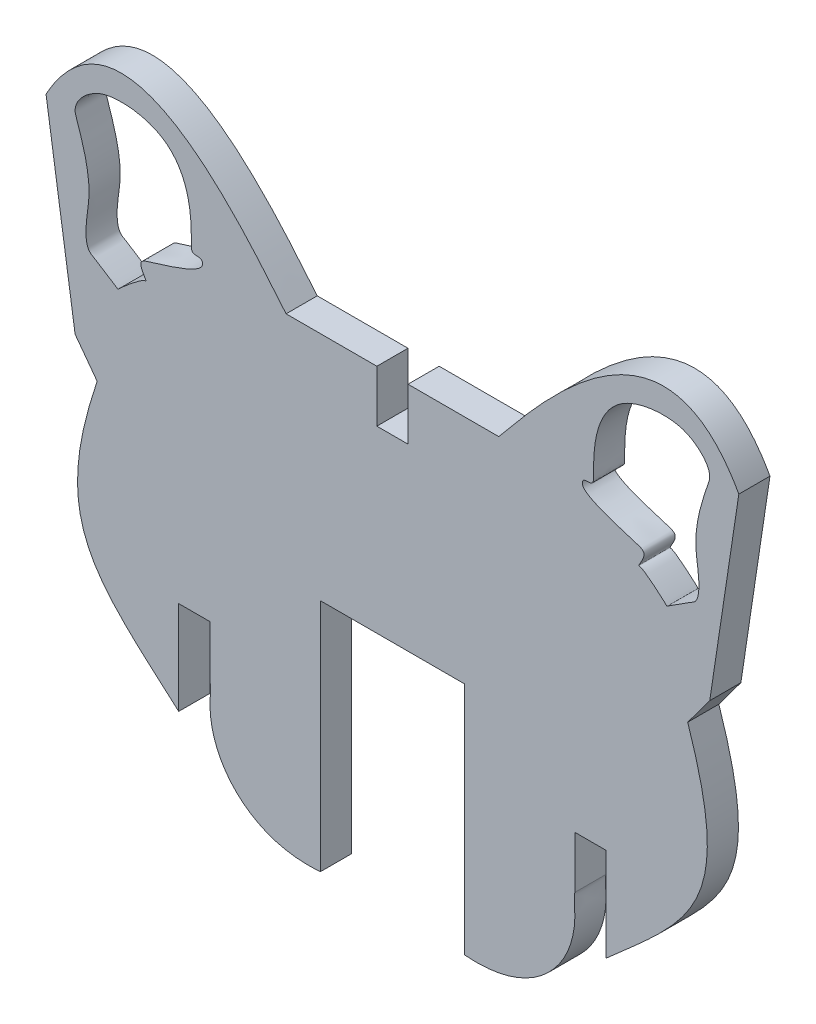
from build123d import *

# Parameters (mm, degrees)
BOSS_EXTRUDE1_DEPTH = 3


with BuildPart() as part:
    # Sketch1 → Boss-Extrude1 (new body)
    with BuildSketch(Plane.XY):
        with BuildLine():
            Line((-6.9235, -22.594), (-6.9235, 0))
            Line((-6.9235, 0), (6.9235, 0))
            Line((6.9235, 0), (6.9235, -22.594))
            add(Edge.make_bspline(
                [(17.583, -12.059), (17.454198014, -12.424689237), (18.268985251, -18.04374019), (13.651472591, -23.218102232), (6.9235, -22.594)],
                knots=[0.209243569, 0.209243569, 0.209243569, 0.209243569, 0.288319212, 1, 1, 1, 1], degree=3))
            Line((17.583, -12.059), (17.583, -7.064))
            Line((17.583, -7.064), (20.583, -7.064))
            Line((20.583, -7.064), (20.583, -12.059))
            Line((20.583, -12.059), (20.583, -16.059))
            add(Edge.make_bspline(
                [(28.43834454, 7.552564304), (32.997632777, -6.01858174), (28.880897212, -8.736665621), (20.583, -16.059)],
                knots=[0, 0, 0, 0, 1, 1, 1, 1], degree=3))
            Line((28.43834454, 7.552564304), (30.561182437, 10.410230704))
            Line((30.561182437, 10.410230704), (33.362355672, 29.038587718))
            add(Edge.make_bspline(
                [(10.240773283, 22.27581246), (15.135283881, 28.20820674), (26.207060441, 42.009865942), (33.362355672, 29.038587718)],
                knots=[0, 0, 0, 0, 1, 1, 1, 1], degree=3))
            Line((10.240773283, 22.27581246), (1.5, 22.27581246))
            Line((1.5, 22.27581246), (1.5, 17.27581246))
            Line((1.5, 17.27581246), (-1.5, 17.27581246))
            Line((-1.5, 17.27581246), (-1.5, 22.27581246))
            Line((-1.5, 22.27581246), (-10.240773283, 22.27581246))
            add(Edge.make_bspline(
                [(-10.240773283, 22.27581246), (-15.135283881, 28.20820674), (-26.207060441, 42.009865942), (-33.362355672, 29.038587718)],
                knots=[0, 0, 0, 0, 1, 1, 1, 1], degree=3))
            Line((-33.362355672, 29.038587718), (-30.561182437, 10.410230704))
            Line((-30.561182437, 10.410230704), (-28.43834454, 7.552564304))
            add(Edge.make_bspline(
                [(-28.43834454, 7.552564304), (-32.997632777, -6.01858174), (-28.880897212, -8.736665621), (-20.583, -16.059)],
                knots=[0, 0, 0, 0, 1, 1, 1, 1], degree=3))
            Line((-20.583, -16.059), (-20.583, -12.059))
            Line((-20.583, -12.059), (-20.583, -7.064))
            Line((-20.583, -7.064), (-17.583, -7.064))
            Line((-17.583, -7.064), (-17.583, -12.059))
            add(Edge.make_bspline(
                [(-17.583, -12.059), (-17.454198014, -12.424689237), (-18.268985251, -18.04374019), (-13.651472591, -23.218102232), (-6.9235, -22.594)],
                knots=[0.209243569, 0.209243569, 0.209243569, 0.209243569, 0.288319212, 1, 1, 1, 1], degree=3))
        make_face()
        with BuildLine():
            add(Edge.make_bspline(
                [(-30.561182437, 29.038587718), (-30.601623166, 30.010444924), (-29.120836323, 31.466231074), (-26.064738145, 32.261723033), (-22.48399757, 31.783283887), (-19.114990892, 27.782359473), (-19.462654323, 23.362216847), (-19.18605135, 22.648770217), (-18.356186086, 22.994318154), (-18.129279767, 21.670769044), (-21.330074211, 20.637436805), (-24.703897253, 19.639847226), (-23.585799072, 18.209732946), (-24.109830269, 18.319361016), (-26.536535198, 16.197923611), (-26.380468497, 16.215587772), (-28.323143016, 17.466208872), (-29.717186117, 18.236839888), (-29.457260609, 20.648185595), (-28.984293969, 23.970363263), (-29.798146424, 26.721408613), (-30.551157112, 28.797662683), (-30.561182437, 29.038587718)],
                knots=[0, 0, 0, 0, 0.04890104, 0.062538941, 0.12817456, 0.147398247, 0.235552127, 0.259495513, 0.362888729, 0.39835219, 0.578666669, 0.60653717, 0.649186703, 0.665467265, 0.75306223, 0.76927242, 0.811358977, 0.822835167, 0.87255813, 0.890896151, 0.98787735, 1, 1, 1, 1], degree=3))
        make_face(mode=Mode.SUBTRACT)
        with BuildLine():
            add(Edge.make_bspline(
                [(30.561182437, 29.038587718), (30.601623166, 30.010444924), (29.120836323, 31.466231074), (26.064738145, 32.261723033), (22.48399757, 31.783283887), (19.114990892, 27.782359473), (19.462654323, 23.362216847), (19.18605135, 22.648770217), (18.356186086, 22.994318154), (18.129279767, 21.670769044), (21.330074211, 20.637436805), (24.703897253, 19.639847226), (23.585799072, 18.209732946), (24.109830269, 18.319361016), (26.536535198, 16.197923611), (26.380468497, 16.215587772), (28.323143016, 17.466208872), (29.717186117, 18.236839888), (29.457260609, 20.648185595), (28.984293969, 23.970363263), (29.798146424, 26.721408613), (30.551157112, 28.797662683), (30.561182437, 29.038587718)],
                knots=[0, 0, 0, 0, 0.04890104, 0.062538941, 0.12817456, 0.147398247, 0.235552127, 0.259495513, 0.362888729, 0.39835219, 0.578666669, 0.60653717, 0.649186703, 0.665467265, 0.75306223, 0.76927242, 0.811358977, 0.822835167, 0.87255813, 0.890896151, 0.98787735, 1, 1, 1, 1], degree=3))
        make_face(mode=Mode.SUBTRACT)
    extrude(amount=BOSS_EXTRUDE1_DEPTH)


solid = part.part
